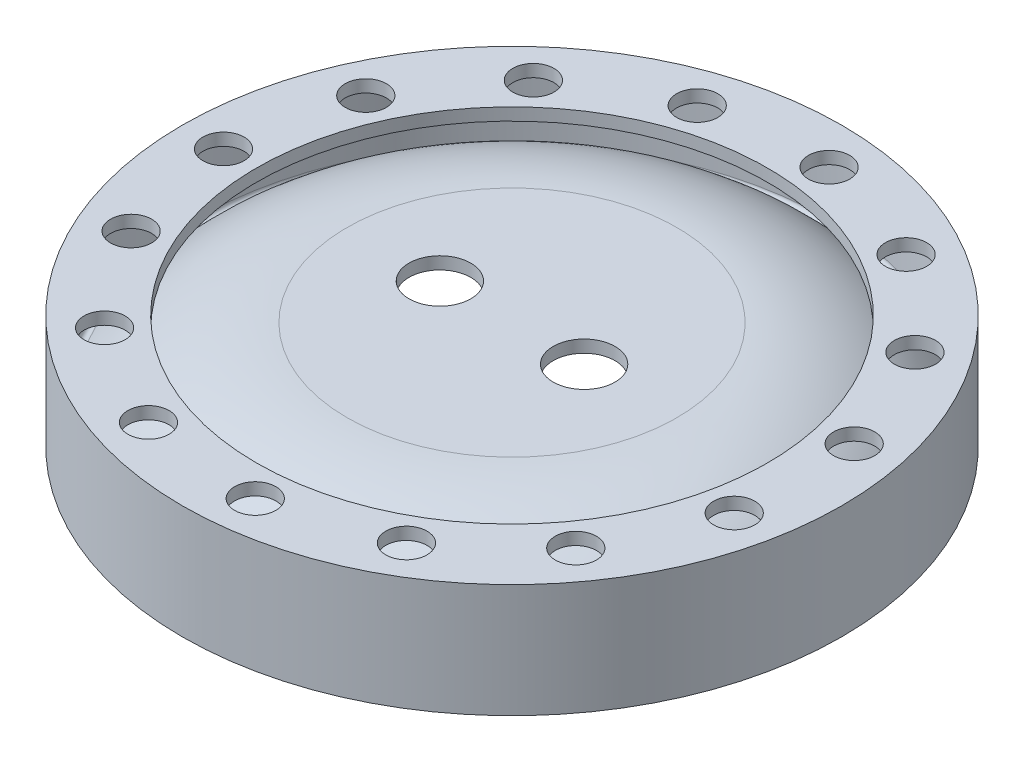
from build123d import *

# Parameters (mm, degrees)
SKETCH2_R          = 9.525
CUT_EXTRUDE1_DEPTH = 148.442344892
SKETCH3_R          = 6.35
CUT_EXTRUDE2_DEPTH = 3.81
CIRPATTERN1_COUNT  = 15
FILLET1_R          = 1.27


with BuildPart() as part:
    # Sketch1 → Revolve1 (revolve)
    with BuildSketch(Plane.XY, mode=Mode.PRIVATE) as revolve1_sk:
        with BuildLine():
            Line((0, 25.4), (50.8, 25.4))
            ThreePointArc((50.8, 25.4), (77.507770873, 18.643626115), (97.79, 0))
            Line((97.79, 0), (97.79, 23.495))
            Line((97.79, 23.495), (78.74, 23.495))
            Line((78.74, 23.495), (78.74, 27.305))
            Line((78.74, 27.305), (101.6, 27.305))
            Line((101.6, 27.305), (101.6, -7.677561287))
            Line((101.6, -7.677561287), (97.79, -7.677561287))
            ThreePointArc((97.79, -7.677561287), (78.479641633, 13.674794519), (50.8, 21.59))
            Line((50.8, 21.59), (0, 21.59))
            Line((0, 21.59), (0, 25.4))
        make_face()
    revolve(revolve1_sk.sketch.rotate(Axis((0, 25.4, 0), (0, -1, 0)), 90), axis=Axis((0, 25.4, 0), (0, -1, 0)))

    # Sketch2 → Cut-Extrude1 (cut, through all)
    with BuildSketch(Plane(origin=(0, 25.4, 0), x_dir=(1, 0, 0), z_dir=(0, 1, 0))):
        with Locations(Location((-22.225, 0, 0), (0, 0, 270))):
            Circle(SKETCH2_R)
        with Locations(Location((22.225, 0, 0), (0, 0, 270))):
            Circle(SKETCH2_R)
    extrude(amount=-CUT_EXTRUDE1_DEPTH, mode=Mode.SUBTRACT)

    # Sketch3 → Cut-Extrude2 (cut)
    with BuildSketch(Plane(origin=(0, 27.305, 0), x_dir=(1, 0, 0), z_dir=(0, 1, 0))):
        with Locations(Location((-88.9, 0, 0), (0, 0, 270))):
            Circle(SKETCH3_R)
    cut_extrude2 = extrude(amount=-CUT_EXTRUDE2_DEPTH, mode=Mode.SUBTRACT)

    # CirPattern1: Cut-Extrude2 ×15 about axis
    cirpattern1_axis = Axis((0, 0, 0), (0, 1, 0))
    for i in range(1, CIRPATTERN1_COUNT):
        add(cut_extrude2.rotate(cirpattern1_axis, i * 360 / CIRPATTERN1_COUNT), mode=Mode.SUBTRACT)

    # Fillet1
    fillet1_edges = [part.edges().sort_by_distance(p)[0] for p in [
        (0, 23.495, -97.79),
        (0, 0, -97.79),
    ]]
    fillet(fillet1_edges, radius=FILLET1_R)


solid = part.part
